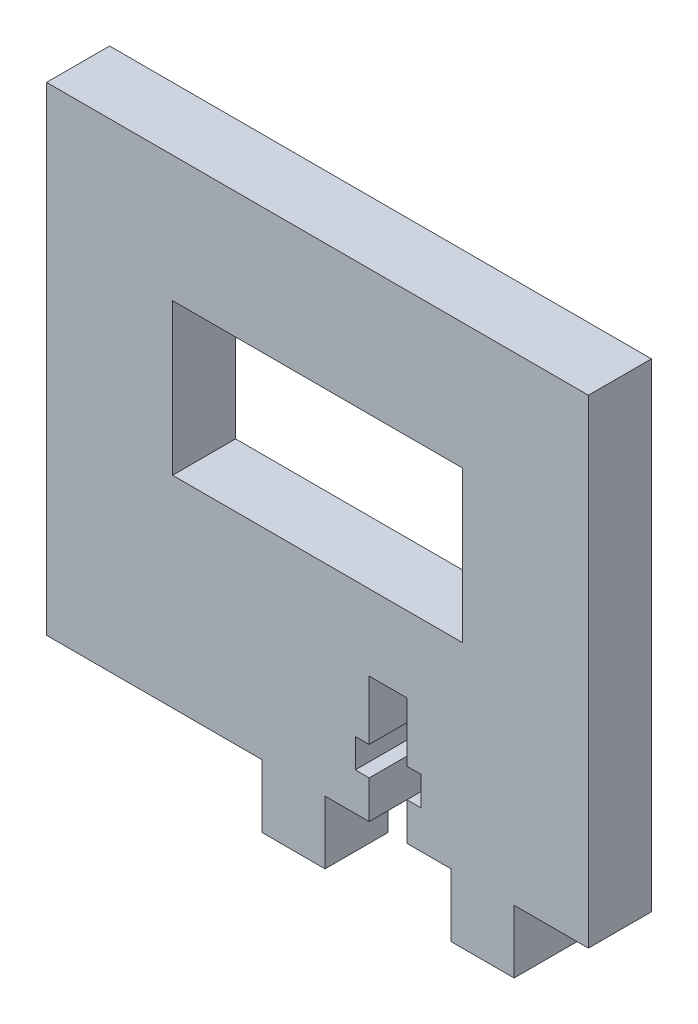
from build123d import *

# Parameters (mm, degrees)
SKETCH1_W           = 5
SKETCH1_H           = 5
SKETCH1_W_2         = 23
SKETCH1_H_2         = 12
BOSS_EXTRUDE3_DEPTH = 5


with BuildPart() as part:
    # Sketch1 → Boss-Extrude3 (new body)
    # profile 1 of 3: a face of its own
    with BuildSketch(Plane.XY):
        with Locations((-7.5, -24.5)):
            Rectangle(SKETCH1_W, SKETCH1_H)
    # profile 2 of 3: a face of its own
    with BuildSketch(Plane.XY):
        with Locations((7.5, -24.5)):
            Rectangle(SKETCH1_W, SKETCH1_H)
    # profile 3 of 3: a face of its own
    with BuildSketch(Plane.XY):
        Polygon((-27.1, 16), (-27.1, -22), (-10, -22), (-5, -22), (-1.5, -22), (-1.5, -19), (-2.6, -19), (-2.6, -16.7), (-1.5, -16.7), (-1.5, -12), (1.5, -12), (1.5, -16.7), (2.6, -16.7), (2.6, -19), (1.5, -19), (1.5, -22), (5, -22), (10, -22), (15.9, -22), (15.9, 16), align=None)
        with Locations((-5.6, 0)):
            Rectangle(SKETCH1_W_2, SKETCH1_H_2, mode=Mode.SUBTRACT)
    extrude(amount=BOSS_EXTRUDE3_DEPTH)


solid = part.part
